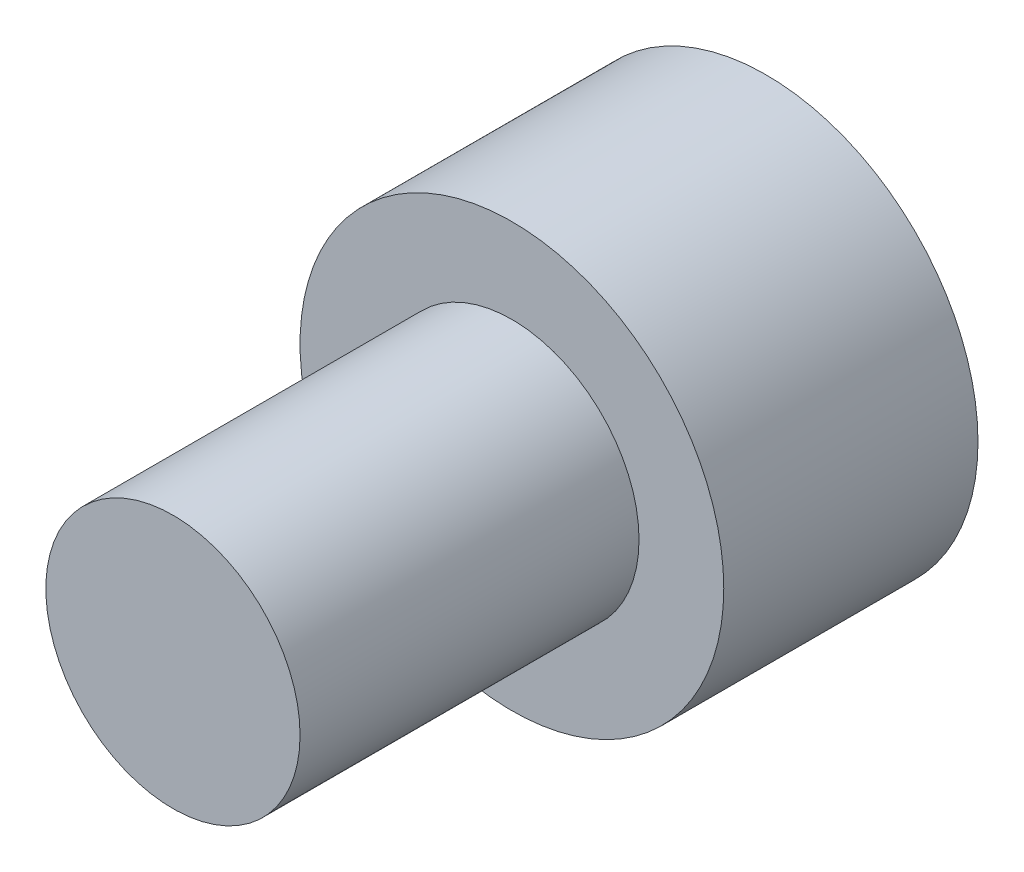
from build123d import *

# Parameters (mm, degrees)
ESBO_O1_R                = 5
RESSALTO_EXTRUS_O1_DEPTH = 6
ESBO_O2_R                = 3
RESSALTO_EXTRUS_O2_DEPTH = 8
CORTE_EXTRUS_O1_DEPTH    = 4


with BuildPart() as part:
    # Esboço1 → Ressalto-extrusão1 (new body)
    with BuildSketch(Plane.XY):
        Circle(ESBO_O1_R)
    extrude(amount=RESSALTO_EXTRUS_O1_DEPTH)

    # Esboço2 → Ressalto-extrusão2 (add)
    with BuildSketch(Plane.XY.offset(6)):
        Circle(ESBO_O2_R)
    extrude(amount=RESSALTO_EXTRUS_O2_DEPTH)

    # Esboço1<4> → Corte-extrusão1 (cut)
    with BuildSketch(Plane.XY):
        Polygon((-1.443375673, 2.5), (-2.886751346, 0), (-1.443375673, -2.5), (1.443375673, -2.5), (2.886751346, 0), (1.443375673, 2.5), align=None)
    extrude(amount=CORTE_EXTRUS_O1_DEPTH, mode=Mode.SUBTRACT)


solid = part.part
